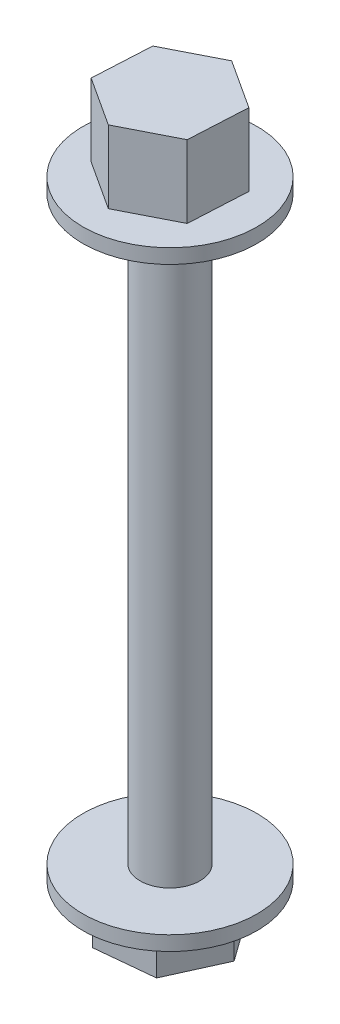
from build123d import *

# Parameters (mm, degrees)
SKETCH1_R           = 3.2639
BOSS_EXTRUDE1_DEPTH = 63.5
SKETCH2_R           = 9.525
BOSS_EXTRUDE2_DEPTH = 1.5875
BOSS_EXTRUDE3_START = 1.5875
SKETCH3_R           = 9.525
BOSS_EXTRUDE3_DEPTH = 1.5875
BOSS_EXTRUDE4_DEPTH = 4.7625
BOSS_EXTRUDE5_DEPTH = 7.9375


with BuildPart() as part:
    # Sketch1 → Boss-Extrude1 (new body)
    with BuildSketch(Plane(origin=(0, 0, 0), x_dir=(1, 0, 0), z_dir=(0, 1, 0))):
        with Locations(Location((0, 0, 0), (0, 0, 270))):
            Circle(SKETCH1_R)
    extrude(amount=BOSS_EXTRUDE1_DEPTH)

    # Sketch2 → Boss-Extrude2 (add)
    with BuildSketch(Plane(origin=(0, 63.5, 0), x_dir=(1, 0, 0), z_dir=(0, 1, 0))):
        with Locations(Location((0, 0, 0), (0, 0, 270))):
            Circle(SKETCH2_R)
    extrude(amount=BOSS_EXTRUDE2_DEPTH)

    # Sketch3 → Boss-Extrude3 (add)
    with BuildSketch(Plane.XZ.offset(BOSS_EXTRUDE3_START)):
        with Locations(Location((0, 0, 0), (0, 0, 90))):
            Circle(SKETCH3_R)
    extrude(amount=-BOSS_EXTRUDE3_DEPTH)

    # Sketch4 → Boss-Extrude4 (add)
    with BuildSketch(Plane.XZ.offset(1.5875)):
        Polygon((3.739867225, 5.213055267), (-2.64470468, 5.845347658), (-6.384571906, 0.63229239), (-3.739867225, -5.213055267), (2.64470468, -5.845347658), (6.384571906, -0.63229239), align=None)
    extrude(amount=BOSS_EXTRUDE4_DEPTH)

    # Sketch5 → Boss-Extrude5 (add)
    with BuildSketch(Plane(origin=(0, 65.0875, 0), x_dir=(1, 0, 0), z_dir=(0, 1, 0))):
        Polygon((5.379355204, -3.496439571), (5.717683093, 2.910438477), (0.33832789, 6.406878048), (-5.379355204, 3.496439571), (-5.717683093, -2.910438477), (-0.33832789, -6.406878048), align=None)
    extrude(amount=BOSS_EXTRUDE5_DEPTH)


solid = part.part
